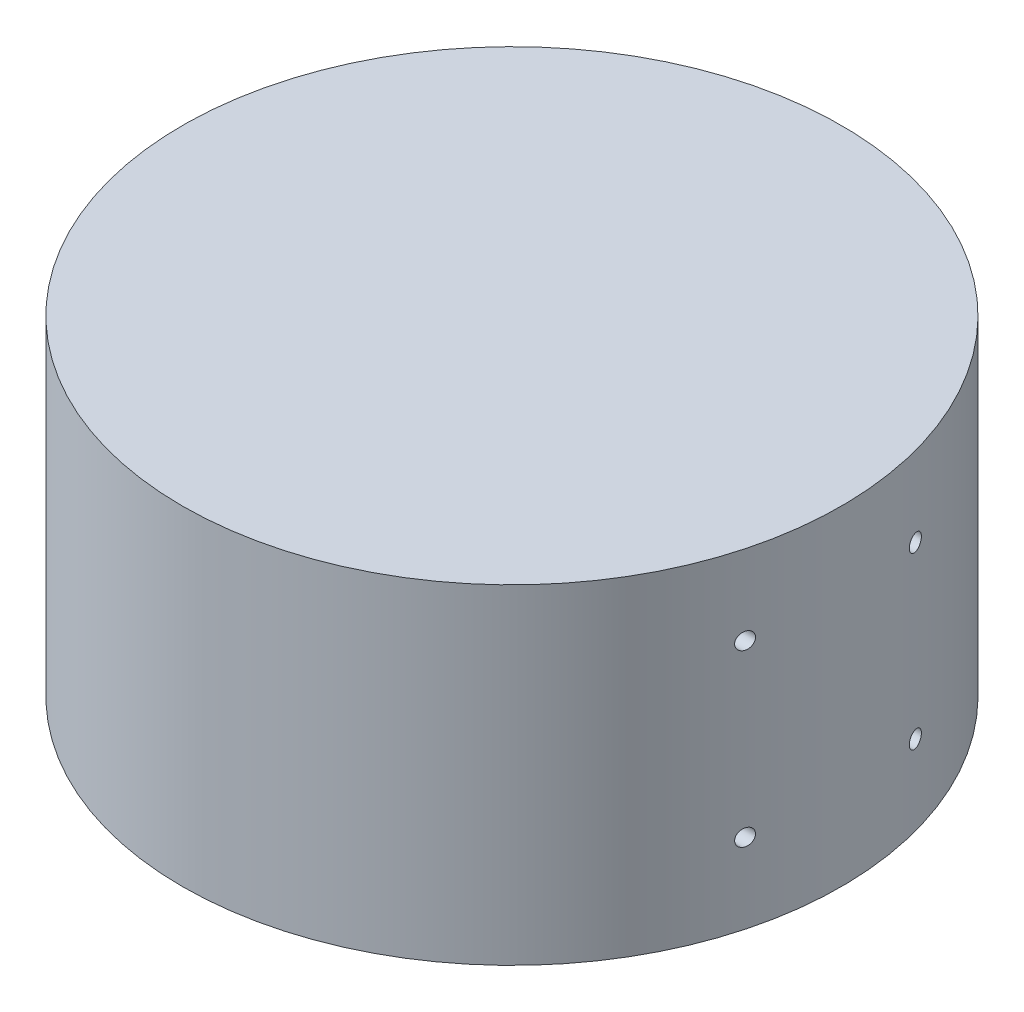
from build123d import *

# Parameters (mm, degrees)
SKETCH1_R           = 60
BOSS_EXTRUDE1_DEPTH = 60
SKETCH2_R           = 10
CUT_EXTRUDE1_DEPTH  = 20
SKETCH3_R           = 1.5
CUT_EXTRUDE2_DEPTH  = 100


with BuildPart() as part:
    # Sketch1 → Boss-Extrude1 (new body)
    with BuildSketch(Plane(origin=(0, 0, 0), x_dir=(1, 0, 0), z_dir=(0, 1, 0))):
        Circle(SKETCH1_R)
    extrude(amount=BOSS_EXTRUDE1_DEPTH)

    # Sketch2 → Cut-Extrude1 (cut)
    with BuildSketch(Plane(origin=(0, 0, 0), x_dir=(1, 0, 0), z_dir=(0, 1, 0))):
        Circle(SKETCH2_R)
    extrude(amount=CUT_EXTRUDE1_DEPTH, mode=Mode.SUBTRACT)

    # Sketch3 → Cut-Extrude2 (cut)
    with BuildSketch(Plane(origin=(0, 0, 0), x_dir=(0, 0, -1), z_dir=(1, 0, 0))):
        with Locations((-15.5, 45.5)):
            Circle(SKETCH3_R)
        with Locations((-15.5, 14.5)):
            Circle(SKETCH3_R)
        with Locations((15.5, 14.5)):
            Circle(SKETCH3_R)
        with Locations((15.5, 45.5)):
            Circle(SKETCH3_R)
    extrude(amount=CUT_EXTRUDE2_DEPTH, mode=Mode.SUBTRACT)


solid = part.part
